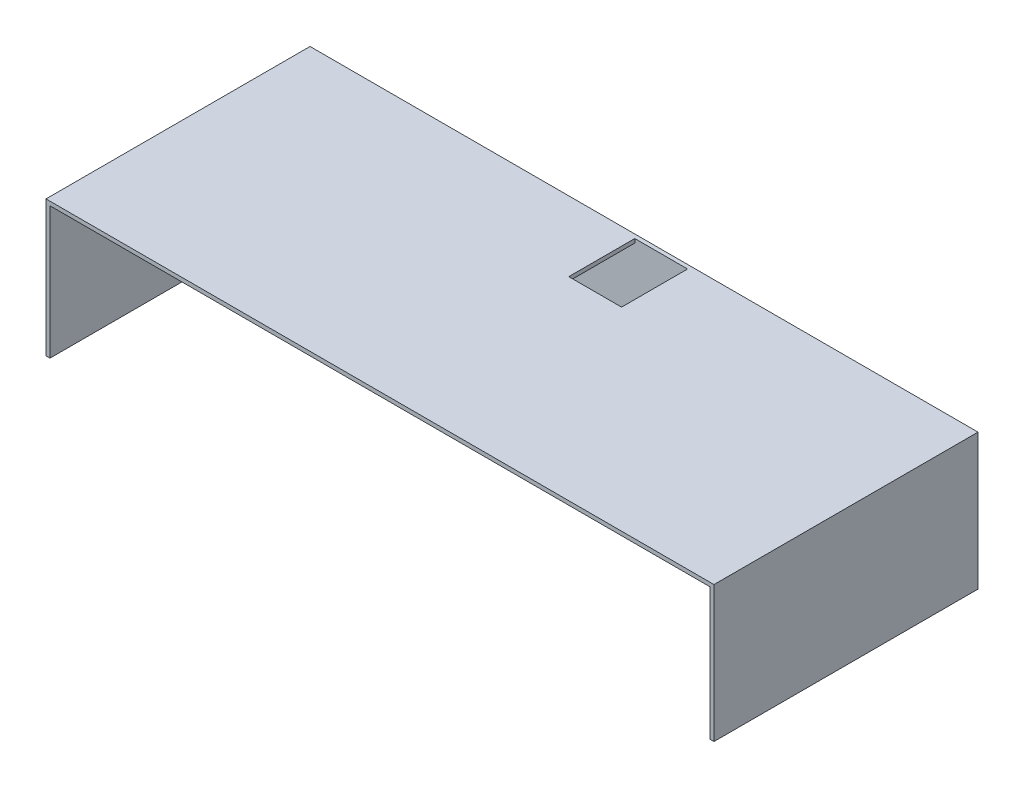
from build123d import *

# Parameters (mm, degrees)
SKETCH_1_W          = 50000
SKETCH_1_H          = 10000
EXTRUDE_1_DEPTH     = 300
SKETCH_3_W          = 20000
SKETCH_3_H          = 10000
EXTRUDE_2_DEPTH     = 300
SKETCH_4_W          = 50300
SKETCH_4_H          = 20000
EXTRUDE_3_DEPTH     = 300
SKETCH_5_W          = 20000
SKETCH_5_H          = 10300
EXTRUDE_4_DEPTH     = 300
CUT_EXTRUDE_1_DEPTH = 300


with BuildPart() as part:
    # 草图1 → 凸台-拉伸1 (new body)
    with BuildSketch(Plane.XY):
        Rectangle(SKETCH_1_W, SKETCH_1_H)
    extrude(amount=EXTRUDE_1_DEPTH)

    # 草图3 → 凸台-拉伸2 (add)
    with BuildSketch(Plane.ZY.offset(25000)):
        with Locations((10000, 0)):
            Rectangle(SKETCH_3_W, SKETCH_3_H)
    extrude(amount=EXTRUDE_2_DEPTH)

    # 草图4 → 凸台-拉伸3 (add)
    with BuildSketch(Plane(origin=(0, 5000, 0), x_dir=(1, 0, 0), z_dir=(0, 1, 0))):
        with Locations((-150, -10000)):
            Rectangle(SKETCH_4_W, SKETCH_4_H)
    extrude(amount=EXTRUDE_3_DEPTH)

    # 草图5 → 凸台-拉伸4 (add)
    with BuildSketch(Plane(origin=(25000, 0, 0), x_dir=(0, 0, -1), z_dir=(1, 0, 0))):
        with Locations((-10000, 150)):
            Rectangle(SKETCH_5_W, SKETCH_5_H)
    extrude(amount=EXTRUDE_4_DEPTH)

    # 草图6 → 切除-拉伸1 (cut)
    with BuildSketch(Plane.XZ.offset(-5000)):
        Polygon((0, 300), (-400, 300), (-400, 5300), (3600, 5300), (3600, 300), align=None)
    extrude(amount=-CUT_EXTRUDE_1_DEPTH, mode=Mode.SUBTRACT)


solid = part.part
